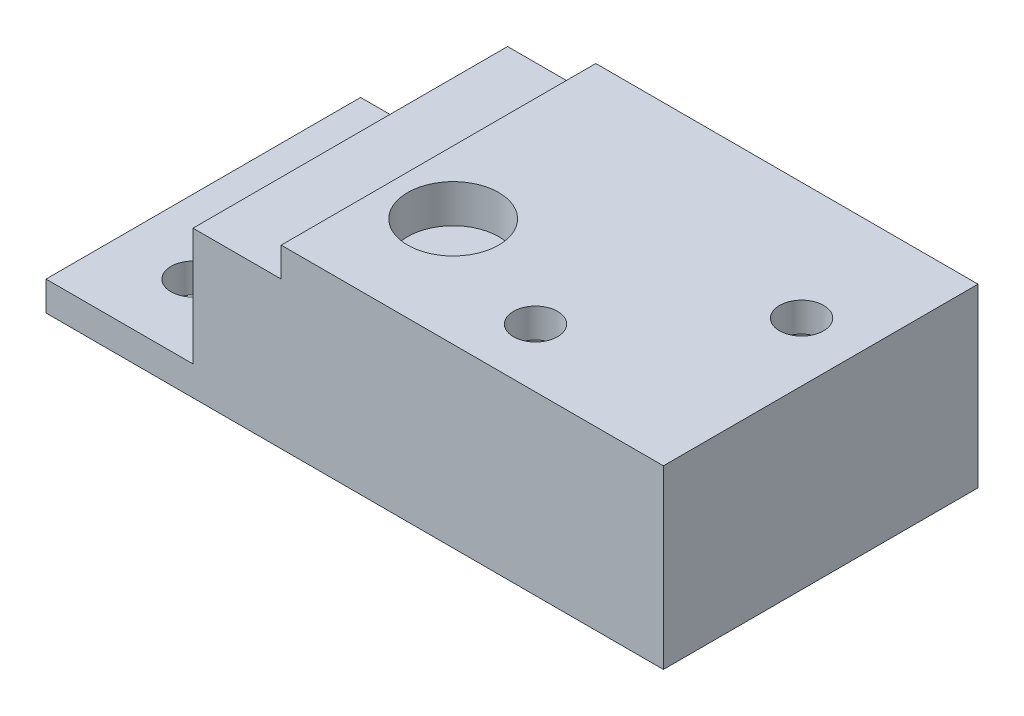
from build123d import *

# Parameters (mm, degrees)
SKETCH_1_W          = 42
SKETCH_1_H          = 21.4
EXTRUDE_1_DEPTH     = 12
SKETCH_2_W          = 6
SKETCH_2_H          = 2
CUT_EXTRUDE_1_DEPTH = 49.641134855
SKETCH_3_R          = 3.1
CUT_EXTRUDE_2_DEPTH = 2.6
SKETCH_4_R          = 2.25
CUT_EXTRUDE_3_DEPTH = 10
SKETCH_4_3_R        = 1.5
CUT_EXTRUDE_4_DEPTH = 49.641134855
SKETCH_5_W          = 88.870895105
SKETCH_5_H          = 42.258480341
CUT_EXTRUDE_5_DEPTH = 53.01884274


with BuildPart() as part:
    # 草图1 → 凸台-拉伸1 (new body)
    with BuildSketch(Plane(origin=(0, 0, 0), x_dir=(1, 0, 0), z_dir=(0, 1, 0))):
        with Locations((21, -10.7)):
            Rectangle(SKETCH_1_W, SKETCH_1_H)
    extrude(amount=EXTRUDE_1_DEPTH)

    # 草图2 → 切除-拉伸1 (cut, through all)
    with BuildSketch(Plane(origin=(0, 0, 0), x_dir=(-1, 0, 0), z_dir=(0, 0, -1))):
        Polygon((-10, 0), (0, 0), (0, 10), (-10, 10), (-10, 2), align=None)
        with Locations((-13, 1)):
            Rectangle(SKETCH_2_W, SKETCH_2_H)
    extrude(amount=-CUT_EXTRUDE_1_DEPTH, mode=Mode.SUBTRACT)

    # 草图3 → 切除-拉伸2 (cut)
    with BuildSketch(Plane.XZ):
        with Locations(Location((20.3, 14, 0), (0, 0, 270))):
            Circle(SKETCH_3_R)
    extrude(amount=-CUT_EXTRUDE_2_DEPTH, mode=Mode.SUBTRACT)

    # 草图4 → 切除-拉伸3 (cut)
    with BuildSketch(Plane(origin=(0, 12, 0), x_dir=(1, 0, 0), z_dir=(0, 1, 0))):
        with Locations(Location((29.3, -17.4, 0), (0, 0, 270))):
            Circle(SKETCH_4_R)
        with Locations(Location((38, -8, 0), (0, 0, 270))):
            Circle(SKETCH_4_R)
    extrude(amount=-CUT_EXTRUDE_3_DEPTH, mode=Mode.SUBTRACT)

    # 草图4<3> → 切除-拉伸4 (cut, through all)
    with BuildSketch(Plane(origin=(0, 12, 0), x_dir=(1, 0, 0), z_dir=(0, 1, 0))):
        with Locations(Location((5, -5, 0), (0, 0, 270))):
            Circle(SKETCH_4_3_R)
        with Locations(Location((5, -16.4, 0), (0, 0, 270))):
            Circle(SKETCH_4_3_R)
        with Locations(Location((38, -8, 0), (0, 0, 270))):
            Circle(SKETCH_4_3_R)
        with Locations(Location((29.3, -17.4, 0), (0, 0, 270))):
            Circle(SKETCH_4_3_R)
    extrude(amount=-CUT_EXTRUDE_4_DEPTH, mode=Mode.SUBTRACT)


with BuildPart() as body_2:
    # 镜向1: mirrored copy
    add(part.part.mirror(Plane.ZX.offset(-10)))


with BuildPart() as part_1:
    add(part.part)

    # 草图5 → 切除-拉伸5 (cut, through all)
    with BuildSketch(Plane(origin=(0, -10, 0), x_dir=(1, 0, 0), z_dir=(0, 1, 0))):
        with Locations((22.816673382, -12.28482211)):
            Rectangle(SKETCH_5_W, SKETCH_5_H)
    extrude(amount=CUT_EXTRUDE_5_DEPTH, mode=Mode.SUBTRACT)


solid = body_2.part
